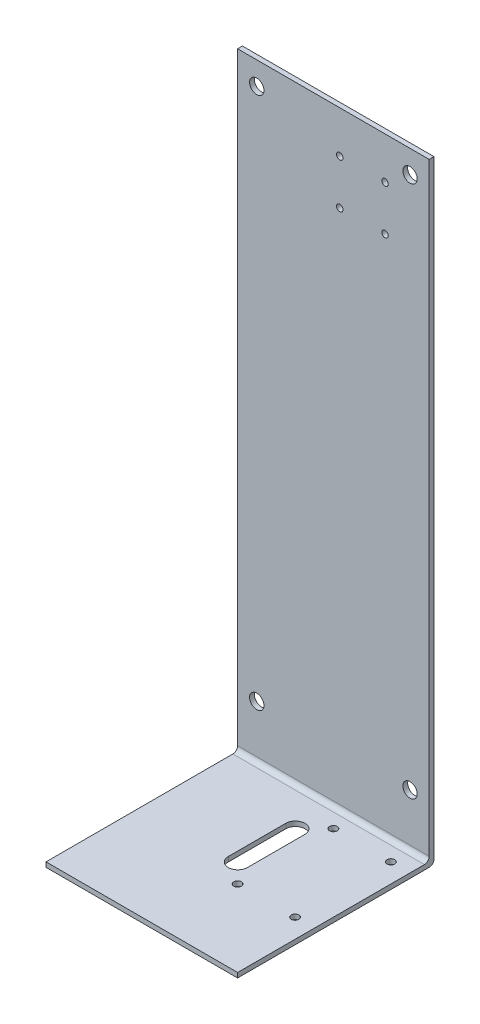
from build123d import *

# Parameters (mm, degrees)
SKETCH2_W           = 127
SKETCH2_H           = 406.4
BOSS_EXTRUDE1_DEPTH = 3.175
SKETCH3_W           = 127
SKETCH3_H           = 3.175
BOSS_EXTRUDE2_DEPTH = 127
FILLET1_R           = 3.175
SKETCH4_R           = 2.54
CUT_EXTRUDE1_DEPTH  = 429.448574802
SKETCH5_R           = 4.7625
SKETCH5_R_2         = 2.15
CUT_EXTRUDE2_DEPTH  = 248.894110458


with BuildPart() as part:
    # Sketch2 → Boss-Extrude1 (new body)
    with BuildSketch(Plane.XY):
        Rectangle(SKETCH2_W, SKETCH2_H)
    extrude(amount=BOSS_EXTRUDE1_DEPTH)

    # Sketch3 → Boss-Extrude2 (add)
    with BuildSketch(Plane.XY.offset(3.175)):
        with Locations((0, -201.6125)):
            Rectangle(SKETCH3_W, SKETCH3_H)
    extrude(amount=BOSS_EXTRUDE2_DEPTH)

    # Fillet1
    fillet1_edges = [part.edges().sort_by_distance(p)[0] for p in [
        (0, -200.025, 3.175),
        (0, -203.2, 0),
    ]]
    fillet(fillet1_edges, radius=FILLET1_R)

    # Sketch4 → Cut-Extrude1 (cut, through all)
    with BuildSketch(Plane(origin=(0, -200.025, 0), x_dir=(1, 0, 0), z_dir=(0, 1, 0))):
        with BuildLine():
            ThreePointArc((-6.167107762, -66.675), (0.182892238, -73.025), (6.532892238, -66.675))
            Line((6.532892238, -66.675), (6.532892238, -28.575))
            ThreePointArc((6.532892238, -28.575), (0.182892238, -22.225), (-6.167107762, -28.575))
            Line((-6.167107762, -28.575), (-6.167107762, -66.675))
        make_face()
        with Locations(Location((12.7, -79.375, 0), (0, 0, 270))):
            Circle(SKETCH4_R)
        with Locations(Location((50.8, -79.375, 0), (0, 0, 270))):
            Circle(SKETCH4_R)
        with Locations(Location((50.8, -15.875, 0), (0, 0, 270))):
            Circle(SKETCH4_R)
        with Locations(Location((12.7, -15.875, 0), (0, 0, 270))):
            Circle(SKETCH4_R)
    extrude(amount=-CUT_EXTRUDE1_DEPTH, mode=Mode.SUBTRACT)

    # Sketch5 → Cut-Extrude2 (cut, through all)
    with BuildSketch(Plane.XY.offset(3.175)):
        with Locations((-50.8, 187.96)):
            Circle(SKETCH5_R)
        with Locations((50.8, 187.96)):
            Circle(SKETCH5_R)
        with Locations((-50.8, -165.1)):
            Circle(SKETCH5_R)
        with Locations((50.8, -165.1)):
            Circle(SKETCH5_R)
        with Locations((34.20875, 175.39)):
            Circle(SKETCH5_R_2)
        with Locations((4.20875, 175.39)):
            Circle(SKETCH5_R_2)
        with Locations((4.20875, 145.69)):
            Circle(SKETCH5_R_2)
        with Locations((34.20875, 145.69)):
            Circle(SKETCH5_R_2)
    extrude(amount=-CUT_EXTRUDE2_DEPTH, mode=Mode.SUBTRACT)


solid = part.part
